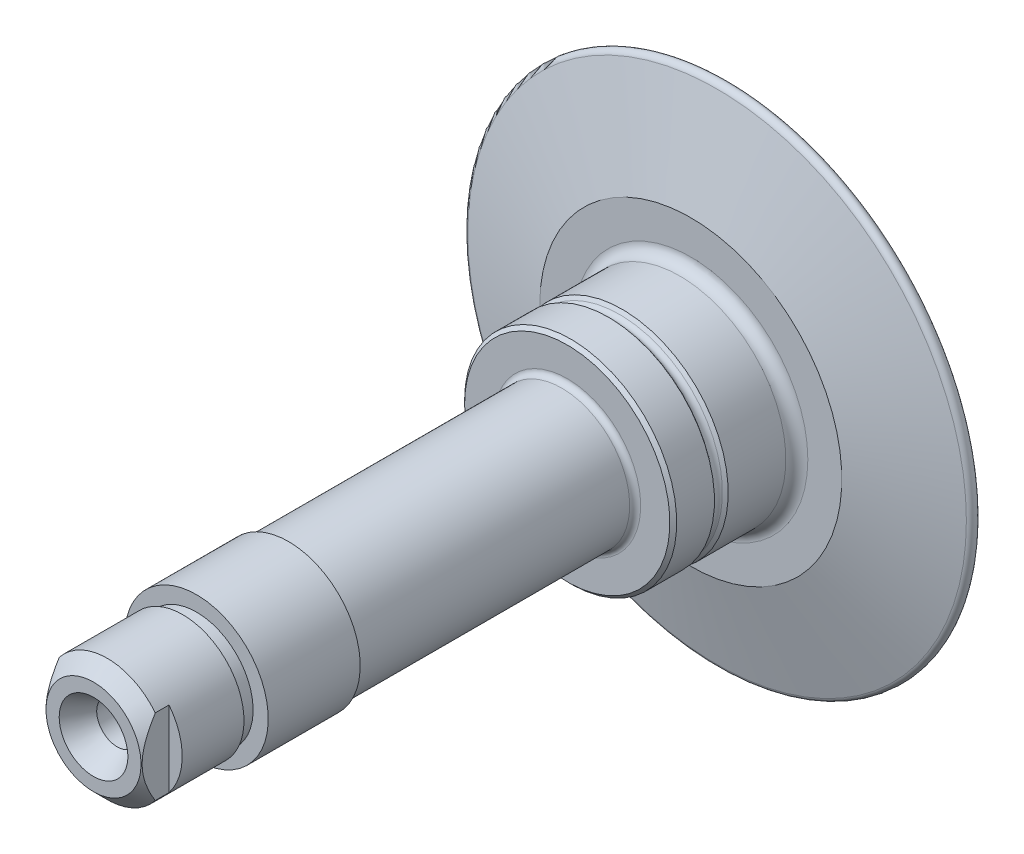
from build123d import *

# Parameters (mm, degrees)
SKETCH2_W          = 5.640914366
SKETCH2_H          = 12.238248986
CUT_EXTRUDE1_DEPTH = 2


with BuildPart() as part:
    # Sketch1 → Revolve1 (revolve)
    with BuildSketch(Plane(origin=(0, 0, 0), x_dir=(0, 0, -1), z_dir=(1, 0, 0)), mode=Mode.PRIVATE) as revolve1_sk:
        with BuildLine():
            Line((-14.25, 7.725), (-11.5, 7.725))
            Line((-11.5, 7.725), (-11.317341336, 7.486954595))
            ThreePointArc((-11.317341336, 7.486954595), (-11, 7.330459166), (-10.682658664, 7.486954595))
            Line((-10.682658664, 7.486954595), (-10.5, 7.725))
            Line((-10.5, 7.725), (-6.3, 7.725))
            ThreePointArc((-6.3, 7.725), (-5.734314575, 7.959314575), (-5.5, 8.525))
            Line((-5.5, 8.525), (-5.5, 11))
            Line((-5.5, 11), (-3.582937415, 18.154574968))
            ThreePointArc((-3.582937415, 18.154574968), (-3.207079201, 18.449895027), (-2.818065836, 18.172132655))
            ThreePointArc((-2.818065836, 18.172132655), (-0.708701946, 9.194671015), (0, 0))
            Line((0, 0), (-43.267949192, 0))
            Line((-43.267949192, 0), (-44.169240121, 1.5))
            Line((-44.169240121, 1.5), (-47.267949192, 1.5))
            Line((-47.267949192, 1.5), (-49, 2.5))
            Line((-49, 2.5), (-49, 3.46))
            Line((-49, 3.46), (-48, 4.46))
            Line((-48, 4.46), (-42.5, 4.46))
            Line((-42.5, 4.46), (-42.5, 4.125))
            Line((-42.5, 4.125), (-41.5, 4.125))
            Line((-41.5, 4.125), (-41.5, 5.225))
            Line((-41.5, 5.225), (-34.8, 5.225))
            Line((-34.8, 5.225), (-34.8, 4.95))
            Line((-34.8, 4.95), (-14.9, 4.95))
            ThreePointArc((-14.9, 4.95), (-14.617157288, 5.067157288), (-14.5, 5.35))
            Line((-14.5, 5.35), (-14.5, 7.475))
            Line((-14.5, 7.475), (-14.25, 7.725))
        make_face()
    revolve(revolve1_sk.sketch.rotate(Axis((0, 0, 0), (0, 0, 1)), 90), axis=Axis((0, 0, 0), (0, 0, 1)))

    # Sketch2 → Cut-Extrude1 (cut)
    with BuildSketch(Plane.XY.offset(49)):
        with Locations((6.320457183, 0)):
            Rectangle(SKETCH2_W, SKETCH2_H)
        with Locations((-6.320457183, 0)):
            Rectangle(SKETCH2_W, SKETCH2_H)
    extrude(amount=-CUT_EXTRUDE1_DEPTH, mode=Mode.SUBTRACT)


solid = part.part
